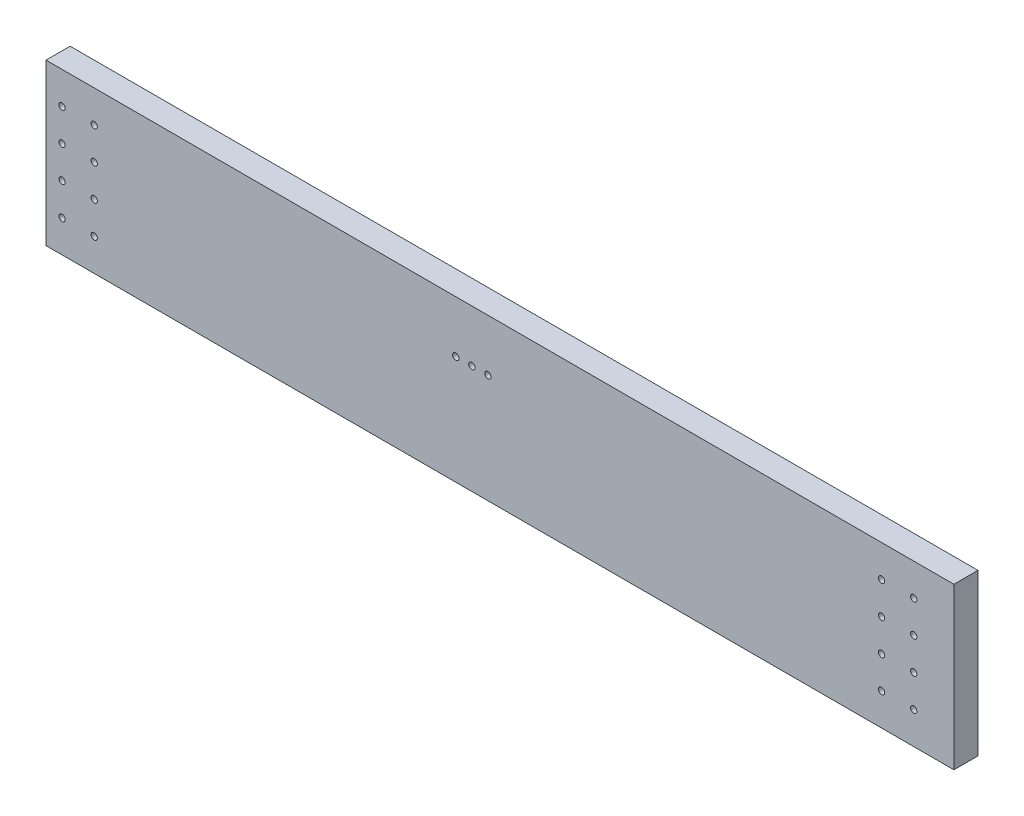
from build123d import *

# Parameters (mm, degrees)
SKETCH1_W           = 717.55
SKETCH1_H           = 127
BOSS_EXTRUDE1_DEPTH = 19.05
SKETCH2_R           = 2.4892
CUT_EXTRUDE1_DEPTH  = 25.4
SKETCH4_R           = 2.4892
CUT_EXTRUDE2_DEPTH  = 729.951236366


with BuildPart() as part:
    # Sketch1 → Boss-Extrude1 (new body)
    with BuildSketch(Plane.XY):
        with Locations((358.775, 63.5)):
            Rectangle(SKETCH1_W, SKETCH1_H)
    extrude(amount=BOSS_EXTRUDE1_DEPTH)

    # Sketch2 → Cut-Extrude1 (cut)
    with BuildSketch(Plane.XY.offset(19.05)):
        with Locations((12.7, 101.6)):
            Circle(SKETCH2_R)
        with Locations((38.1, 101.6)):
            Circle(SKETCH2_R)
        with Locations((38.1, 76.2)):
            Circle(SKETCH2_R)
        with Locations((38.1, 50.8)):
            Circle(SKETCH2_R)
        with Locations((38.1, 25.4)):
            Circle(SKETCH2_R)
        with Locations((12.7, 76.2)):
            Circle(SKETCH2_R)
        with Locations((12.7, 50.8)):
            Circle(SKETCH2_R)
        with Locations((12.7, 25.4)):
            Circle(SKETCH2_R)
        with Locations((685.8, 101.6)):
            Circle(SKETCH2_R)
        with Locations((660.4, 101.6)):
            Circle(SKETCH2_R)
        with Locations((660.4, 76.2)):
            Circle(SKETCH2_R)
        with Locations((660.4, 50.8)):
            Circle(SKETCH2_R)
        with Locations((660.4, 25.4)):
            Circle(SKETCH2_R)
        with Locations((685.8, 76.2)):
            Circle(SKETCH2_R)
        with Locations((685.8, 50.8)):
            Circle(SKETCH2_R)
        with Locations((685.8, 25.4)):
            Circle(SKETCH2_R)
    extrude(amount=-CUT_EXTRUDE1_DEPTH, mode=Mode.SUBTRACT)

    # Sketch4 → Cut-Extrude2 (cut, through all)
    with BuildSketch(Plane.XY.offset(19.05)):
        with Locations((323.85, 85.979)):
            Circle(SKETCH4_R)
        with Locations((336.55, 85.979)):
            Circle(SKETCH4_R)
        with Locations((349.25, 85.979)):
            Circle(SKETCH4_R)
    extrude(amount=-CUT_EXTRUDE2_DEPTH, mode=Mode.SUBTRACT)


solid = part.part
